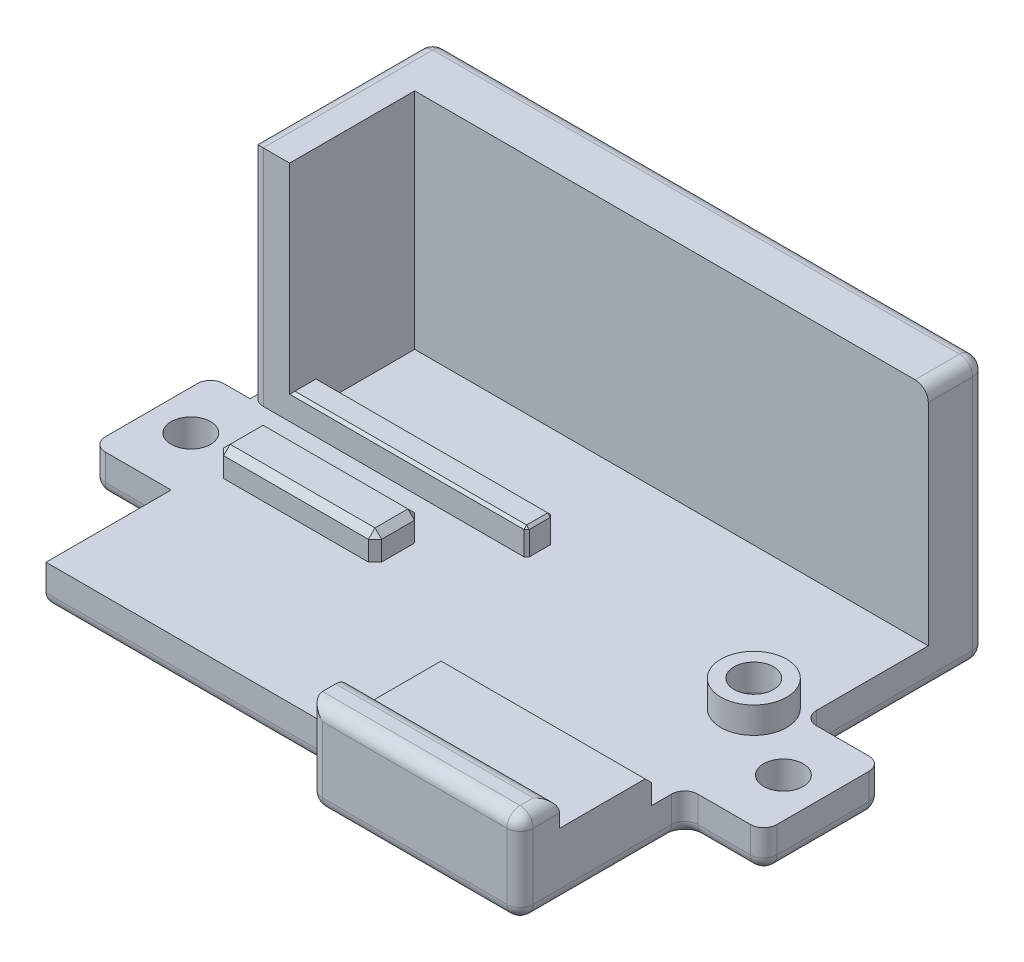
from build123d import *

# Parameters (mm, degrees)
ESQUISSE1_W         = 6
ESQUISSE1_H         = 9
ESQUISSE1_R         = 1.5
ESQUISSE1_W_2       = 39
ESQUISSE1_H_2       = 28
ESQUISSE1_R_2       = 1.55
BOSS_EXTRU_2_DEPTH  = 3
ESQUISSE2_W         = 12
ESQUISSE2_H         = 3.5
BOSS_EXTRU_3_DEPTH  = 2
CHANFREIN1_SIZE     = 0.5
ESQUISSE7_R         = 2.5
ESQUISSE7_R_2       = 1.5
BOSS_EXTRU_6_DEPTH  = 2
ESQUISSE5_W         = 18
ESQUISSE5_H         = 2
BOSS_EXTRU_7_DEPTH  = 5
CHANFREIN2_SIZE     = 0.2
ESQUISSE8_W         = 16
ESQUISSE8_H         = 7
BOSS_EXTRU_8_DEPTH  = 2
CHANFREIN3_SIZE     = 0.5
BOSS_EXTRU_9_DEPTH  = 20
ESQUISSE11_W        = 16
ESQUISSE11_H        = 3
BOSS_EXTRU_10_DEPTH = 7
CONG_1_R            = 1


with BuildPart() as part:
    # Esquisse1 → Boss.-Extru.2 (new body)
    # profile 1 of 3: a face of its own
    with BuildSketch(Plane(origin=(0, 0, 0), x_dir=(1, 0, 0), z_dir=(0, 1, 0))):
        with Locations((-22.5, 0)):
            Rectangle(ESQUISSE1_W, ESQUISSE1_H)
        with Locations(Location((-22.5, 0, 0), (0, 0, 270))):
            Circle(ESQUISSE1_R, mode=Mode.SUBTRACT)
    # profile 2 of 3: a face of its own
    with BuildSketch(Plane(origin=(0, 0, 0), x_dir=(1, 0, 0), z_dir=(0, 1, 0))):
        Rectangle(ESQUISSE1_W_2, ESQUISSE1_H_2)
        with Locations(Location((17, 3.25, 0), (0, 0, 270))):
            Circle(ESQUISSE1_R_2, mode=Mode.SUBTRACT)
    # profile 3 of 3: a face of its own
    with BuildSketch(Plane(origin=(0, 0, 0), x_dir=(1, 0, 0), z_dir=(0, 1, 0))):
        with Locations((22.5, 0)):
            Rectangle(ESQUISSE1_W, ESQUISSE1_H)
        with Locations(Location((22.5, 0, 0), (0, 0, 270))):
            Circle(ESQUISSE1_R, mode=Mode.SUBTRACT)
    extrude(amount=BOSS_EXTRU_2_DEPTH)

    # Esquisse2 → Boss.-Extru.3 (add)
    with BuildSketch(Plane(origin=(0, 3, 0), x_dir=(1, 0, 0), z_dir=(0, 1, 0))):
        with Locations((-12.765224295, 0)):
            Rectangle(ESQUISSE2_W, ESQUISSE2_H)
    extrude(amount=BOSS_EXTRU_3_DEPTH)

    # Chanfrein1
    chanfrein1_edges = [part.edges().sort_by_distance(p)[0] for p in [
        (-18.765224295, 4, -1.75),
        (-18.765224295, 4, 1.75),
        (-6.765224295, 4, 1.75),
        (-6.765224295, 4, -1.75),
        (-18.765224295, 5, 0),
        (-12.765224295, 5, 1.75),
        (-6.765224295, 5, 0),
        (-12.765224295, 5, -1.75),
    ]]
    chamfer(chanfrein1_edges, length=CHANFREIN1_SIZE)

    # Esquisse7 → Boss.-Extru.6 (add)
    with BuildSketch(Plane(origin=(0, 3, 0), x_dir=(1, 0, 0), z_dir=(0, 1, 0))):
        with Locations(Location((17, 3.25, 0), (0, 0, 270))):
            Circle(ESQUISSE7_R)
        with Locations(Location((17, 3.25, 0), (0, 0, 270))):
            Circle(ESQUISSE7_R_2, mode=Mode.SUBTRACT)
    extrude(amount=BOSS_EXTRU_6_DEPTH)

    # Esquisse5 → Boss.-Extru.7 (add)
    with BuildSketch(Plane.XZ):
        with Locations((-10.5, -5.5)):
            Rectangle(ESQUISSE5_W, ESQUISSE5_H)
    extrude(amount=-BOSS_EXTRU_7_DEPTH)

    # Chanfrein2
    chanfrein2_edges = [part.edges().sort_by_distance(p)[0] for p in [
        (-1.5, 4, -4.5),
        (-1.5, 5, -5.5),
        (-1.5, 4, -6.5),
        (-10.5, 5, -6.5),
        (-19.5, 5, -5.5),
        (-10.5, 5, -4.5),
    ]]
    chamfer(chanfrein2_edges, length=CHANFREIN2_SIZE)

    # Esquisse8 → Boss.-Extru.8 (add)
    with BuildSketch(Plane(origin=(0, 3, 0), x_dir=(1, 0, 0), z_dir=(0, 1, 0))):
        with Locations((11.5, -10.5)):
            Rectangle(ESQUISSE8_W, ESQUISSE8_H)
    extrude(amount=BOSS_EXTRU_8_DEPTH)

    # Chanfrein3
    chanfrein3_edges = [part.edges().sort_by_distance(p)[0] for p in [
        (3.5, 4, 7),
        (11.5, 5, 7),
        (3.5, 5, 10.5),
    ]]
    chamfer(chanfrein3_edges, length=CHANFREIN3_SIZE)

    # Esquisse9 → Boss.-Extru.9 (add)
    with BuildSketch(Plane.XZ):
        Polygon((-19.5, -14), (19.5, -14), (19.5, -18.364828329), (-22.5, -18.364828329), (-22.5, -4.5), (-19.5, -4.5), align=None)
    extrude(amount=-BOSS_EXTRU_9_DEPTH)

    # Esquisse11 → Boss.-Extru.10 (add)
    with BuildSketch(Plane.XZ):
        with Locations((11.5, 15.5)):
            Rectangle(ESQUISSE11_W, ESQUISSE11_H)
    extrude(amount=-BOSS_EXTRU_10_DEPTH)

    # Congé1
    cong_1_edges = [part.edges().sort_by_distance(p)[0] for p in [
        (-24, 0, -4.5),
        (-22.5, 11.5, -4.5),
        (19.5, 20, -16.182414164),
        (-1.5, 20, -18.364828329),
        (19.5, 10, -18.364828329),
        (-22.5, 20, -11.432414164),
        (-22.5, 10, -18.364828329),
        (-22.5, 0, -11.432414164),
        (-1.5, 0, -18.364828329),
        (19.5, 0, -11.432414164),
        (22.5, 0, -4.5),
        (11.5, 7, 14),
        (25.5, 0, 0),
        (19.5, 7, 15.5),
        (19.5, 3.5, 17),
        (11.5, 7, 17),
        (3.5, 3.5, 17),
        (11.5, 0, 17),
        (3.5, 0, 15.5),
        (22.5, 0, 4.5),
        (19.5, 0, 10.75),
        (-8, 0, 14),
        (-19.5, 0, 9.25),
        (-22.5, 0, 4.5),
        (-25.5, 0, 0),
        (-25.5, 1.5, -4.5),
        (19.5, 1.5, -4.5),
        (25.5, 1.5, -4.5),
        (25.5, 1.5, 4.5),
        (19.5, 1.5, 4.5),
        (-25.5, 1.5, 4.5),
    ]]
    fillet(cong_1_edges, radius=CONG_1_R)


solid = part.part
